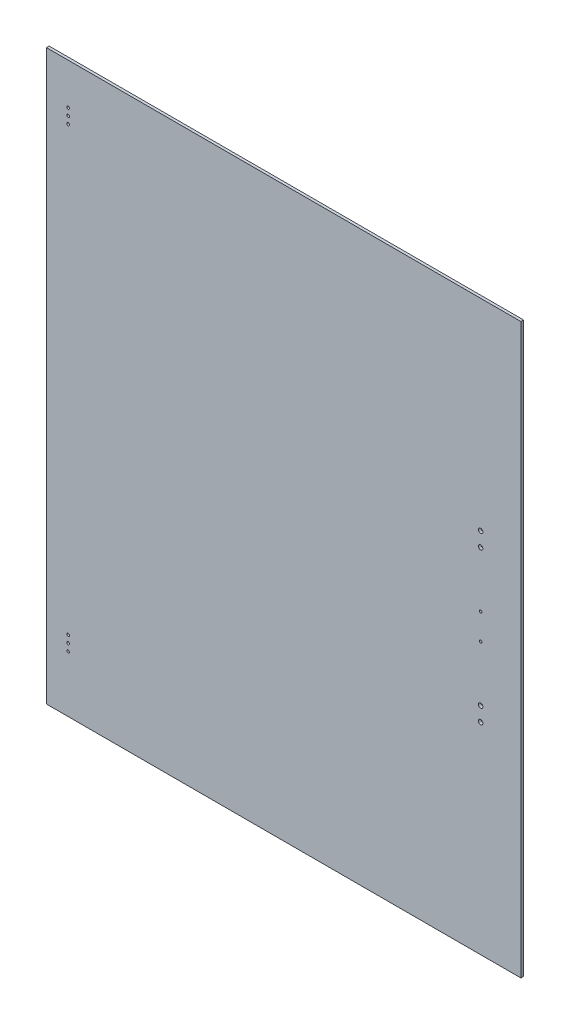
from build123d import *

# Parameters (mm, degrees)
SKETCH1_W           = 530
SKETCH1_H           = 635
BOSS_EXTRUDE1_DEPTH = 3
SKETCH2_R           = 1.5
CUT_EXTRUDE1_DEPTH  = 586.517705704
SKETCH3_R           = 2.5
SKETCH3_R_2         = 1.5
CUT_EXTRUDE2_DEPTH  = 586.517705704


with BuildPart() as part:
    # Sketch1 → Boss-Extrude1 (new body)
    with BuildSketch(Plane.XY):
        with Locations((-211.504854369, -22.742718447)):
            Rectangle(SKETCH1_W, SKETCH1_H)
    extrude(amount=BOSS_EXTRUDE1_DEPTH)

    # Sketch2 → Cut-Extrude1 (cut, through all)
    with BuildSketch(Plane.XY.offset(3)):
        with Locations((-452.244854369, 248.757281553)):
            Circle(SKETCH2_R)
        with Locations((-452.244854369, 240.757281553)):
            Circle(SKETCH2_R)
        with Locations((-452.244854369, 232.757281553)):
            Circle(SKETCH2_R)
        with Locations((-452.244854369, -261.242718447)):
            Circle(SKETCH2_R)
        with Locations((-452.244854369, -269.242718447)):
            Circle(SKETCH2_R)
        with Locations((-452.244854369, -277.242718447)):
            Circle(SKETCH2_R)
    extrude(amount=-CUT_EXTRUDE1_DEPTH, mode=Mode.SUBTRACT)

    # Sketch3 → Cut-Extrude2 (cut, through all)
    with BuildSketch(Plane.XY.offset(3)):
        with Locations((8.495145631, 69.757281553)):
            Circle(SKETCH3_R)
        with Locations((8.495145631, 53.757281553)):
            Circle(SKETCH3_R)
        with Locations((8.495145631, -99.242718447)):
            Circle(SKETCH3_R)
        with Locations((8.495145631, -115.242718447)):
            Circle(SKETCH3_R)
        with Locations((8.495145631, -37.242718447)):
            Circle(SKETCH3_R_2)
        with Locations((8.495145631, -8.242718447)):
            Circle(SKETCH3_R_2)
    extrude(amount=-CUT_EXTRUDE2_DEPTH, mode=Mode.SUBTRACT)


solid = part.part
